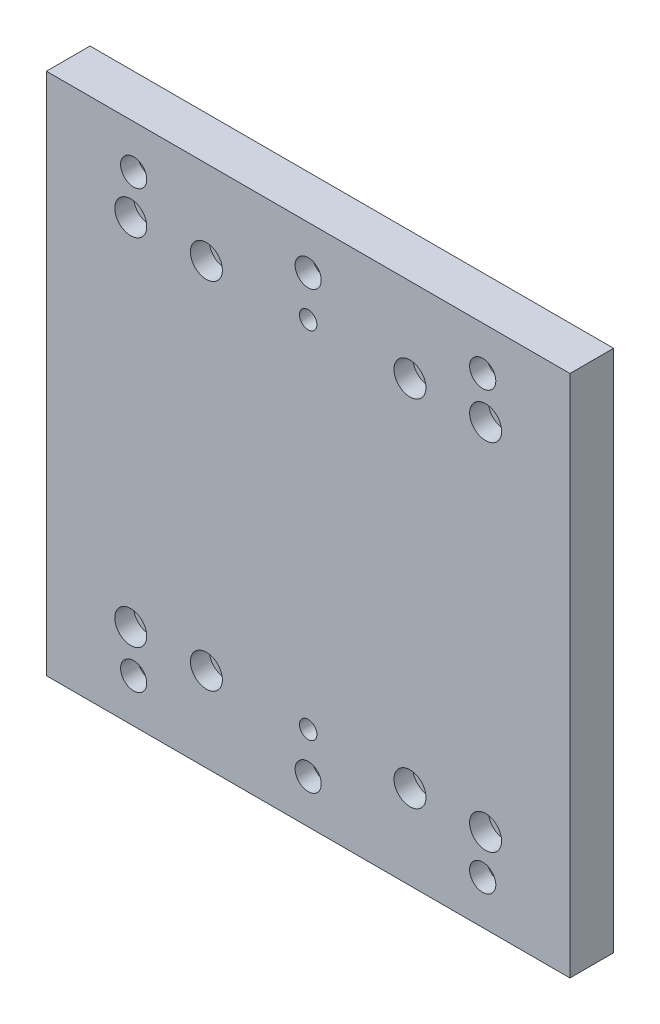
from build123d import *

# Parameters (mm, degrees)
SKETCH_1_W                    = 180
SKETCH_1_H                    = 180
EXTRUDE_1_DEPTH               = 15
HOLE_WIZARD_4_8_1_D           = 6.5
HOLE_WIZARD_4_8_1_CBORE_D     = 11
HOLE_WIZARD_4_8_1_CBORE_DEPTH = 6.5
HOLE_WIZARD_6_0_6_1_D         = 6
HOLE_WIZARD_4_8_2_D           = 9
HOLE_WIZARD_4_8_2_CBORE_D     = 15
HOLE_WIZARD_4_8_2_CBORE_DEPTH = 9


with BuildPart() as part:
    # 草图1 → 凸台-拉伸1 (new body)
    with BuildSketch(Plane.XY):
        Rectangle(SKETCH_1_W, SKETCH_1_H)
    extrude(amount=EXTRUDE_1_DEPTH)

    # 打孔尺寸根据内六角花形圆柱头螺钉-4.8级的类型1 (through all)
    with Locations(Plane(origin=(-61, 61, 15), x_dir=(1, 0, 0), z_dir=(0, 0, 1))):
        with Locations((0, 0), (96, 0), (26, 0), (0, -122), (26, -122), (96, -122), (122, -122), (122, 0)):
            CounterBoreHole(HOLE_WIZARD_4_8_1_D / 2, HOLE_WIZARD_4_8_1_CBORE_D / 2, HOLE_WIZARD_4_8_1_CBORE_DEPTH)

    # Ø6.0 (6) 直径孔1 (through all)
    with Locations(Plane(origin=(0, 61, 15), x_dir=(1, 0, 0), z_dir=(0, 0, 1))):
        with Locations((0, 0), (0, -122)):
            Hole(HOLE_WIZARD_6_0_6_1_D / 2)

    # 打孔尺寸根据内六角花形圆柱头螺钉-4.8级的类型2 (through all)
    with Locations(Plane(origin=(60, 75, 0), x_dir=(-1, 0, 0), z_dir=(0, 0, -1))):
        with Locations((0, 0), (60, 0), (120, 0), (120, -150), (60, -150), (0, -150)):
            CounterBoreHole(HOLE_WIZARD_4_8_2_D / 2, HOLE_WIZARD_4_8_2_CBORE_D / 2, HOLE_WIZARD_4_8_2_CBORE_DEPTH)


solid = part.part
